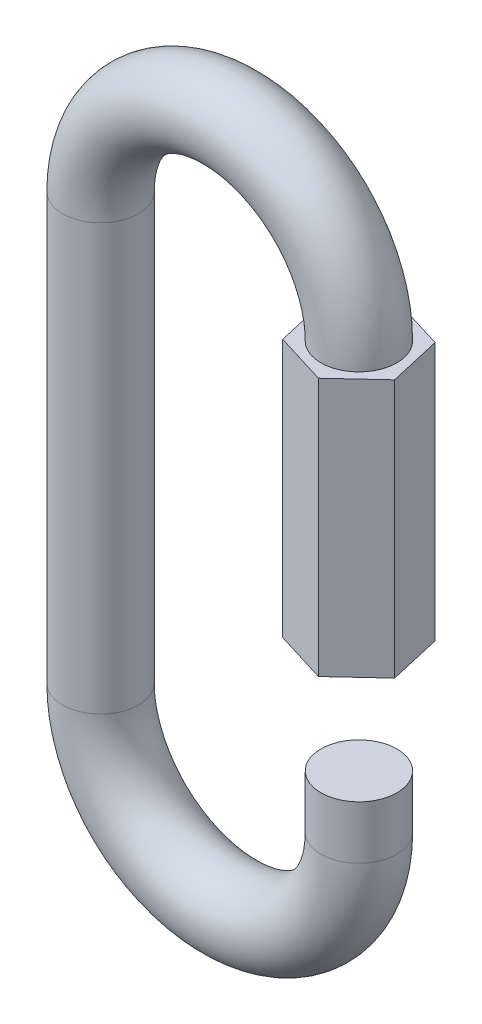
from build123d import *

# Parameters (mm, degrees)
SKETCH1_R           = 2.5
BOSS_EXTRUDE1_DEPTH = 17


with BuildPart() as part:
    # Sweep1: sweep along a path in Sketch2
    with BuildLine(Plane.XY) as sweep1_path:
        Line((0, 0), (0, 17))
        ThreePointArc((0, 17), (-8.5, 25.5), (-17, 17))
        Line((-17, 17), (-17, -11))
        ThreePointArc((-17, -11), (-8.5, -19.5), (0, -11))
        Line((0, -11), (0, -7.5))
    # Sketch1 → Sweep1 (sweep)
    with BuildSketch(Plane(origin=(0, 0, 0), x_dir=(1, 0, 0), z_dir=(0, 1, 0))):
        Circle(SKETCH1_R)
    sweep(path=sweep1_path.line)

    # Sketch3 → Boss-Extrude1 (add)
    with BuildSketch(Plane.XZ):
        Polygon((3.390928287, 1.04359212), (0.791686856, 3.458426099), (-2.599241431, 2.414833979), (-3.390928287, -1.04359212), (-0.791686856, -3.458426099), (2.599241431, -2.414833979), align=None)
    extrude(amount=-BOSS_EXTRUDE1_DEPTH)


solid = part.part
